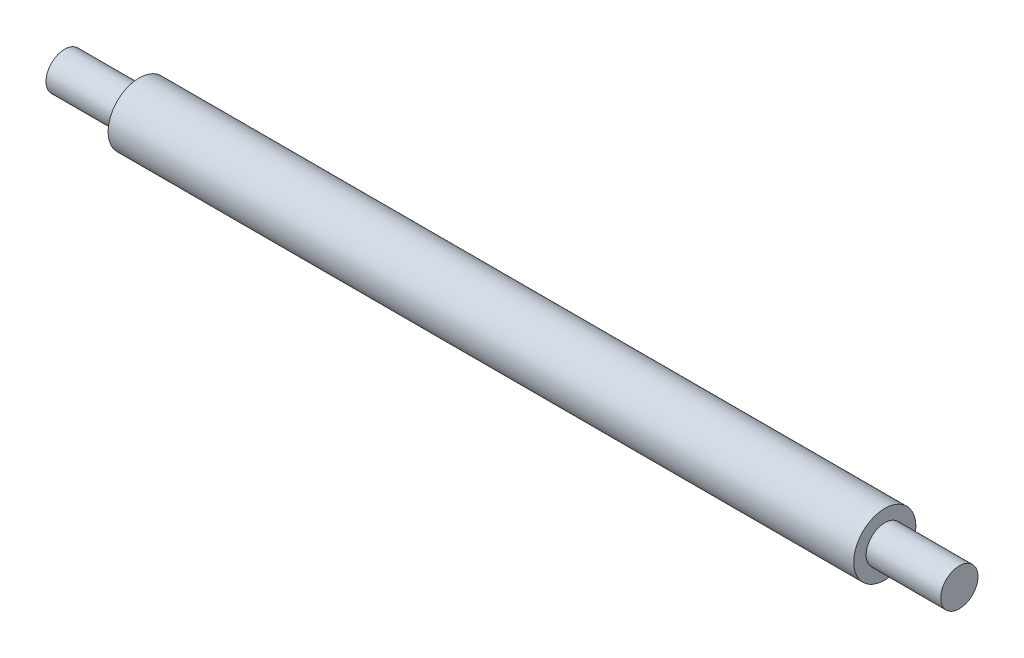
from build123d import *

# Parameters (mm, degrees)
EXTRUDE_1_DEPTH      = 30
EXTRUDE_1_DEPTH_BACK = 30
SKETCH_1_R           = 2.5
SKETCH_2_R           = 1.5
EXTRUDE_2_DEPTH      = 6
EXTRUDE_START        = 6
SKETCH_3_R           = 1.5
EXTRUDE_3_DEPTH      = 6


with BuildPart() as part:
    # 草图1 → 凸台-拉伸1 (new, two sides: drawn at the far end of the back side and taken through both)
    with BuildSketch(Plane(origin=(0, 0, 0), x_dir=(0, 0, -1), z_dir=(1, 0, 0)).offset(-EXTRUDE_1_DEPTH_BACK)):
        Circle(SKETCH_1_R)
    extrude(amount=EXTRUDE_1_DEPTH + EXTRUDE_1_DEPTH_BACK)

    # 草图2 → 凸台-拉伸2 (add)
    with BuildSketch(Plane(origin=(30, 0, 0), x_dir=(0, 0, -1), z_dir=(1, 0, 0))):
        Circle(SKETCH_2_R)
    extrude(amount=EXTRUDE_2_DEPTH)

    # 草图3 → 凸台-拉伸3 (add)
    with BuildSketch(Plane.ZY.offset(30).offset(EXTRUDE_START)):
        Circle(SKETCH_3_R)
    extrude(amount=-EXTRUDE_3_DEPTH)


solid = part.part
